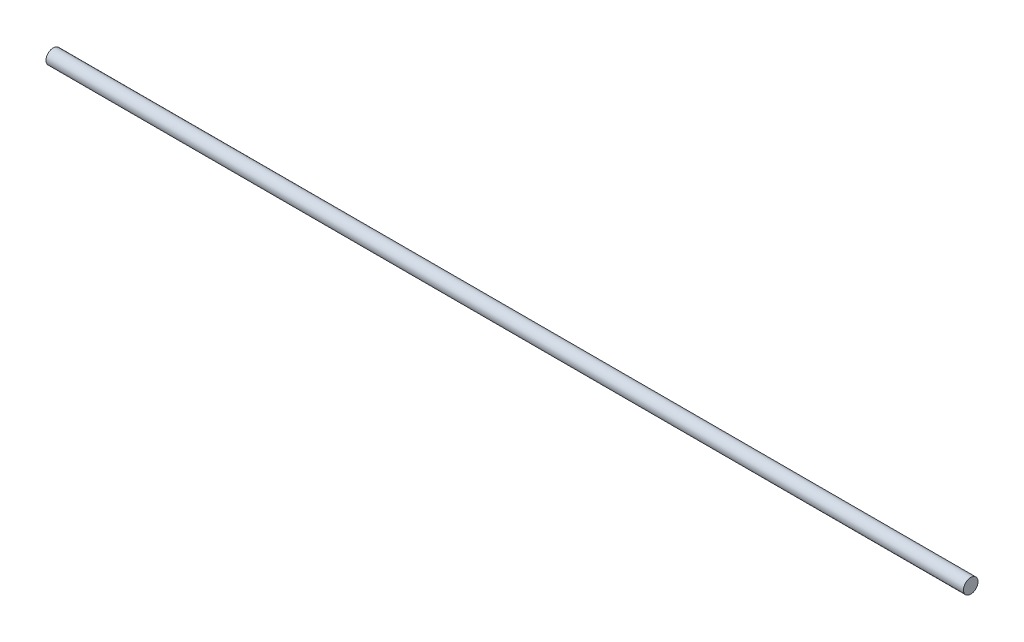
from build123d import *

# Parameters (mm, degrees)
SKETCH1_R           = 3.175
BOSS_EXTRUDE1_DEPTH = 400.05


with BuildPart() as part:
    # Sketch1 → Boss-Extrude1 (new body)
    with BuildSketch(Plane(origin=(0, 0, 0), x_dir=(0, 0, -1), z_dir=(1, 0, 0))):
        with Locations(Location((0, 0, 0), (0, 0, 180))):
            Circle(SKETCH1_R)
    extrude(amount=BOSS_EXTRUDE1_DEPTH)


solid = part.part
